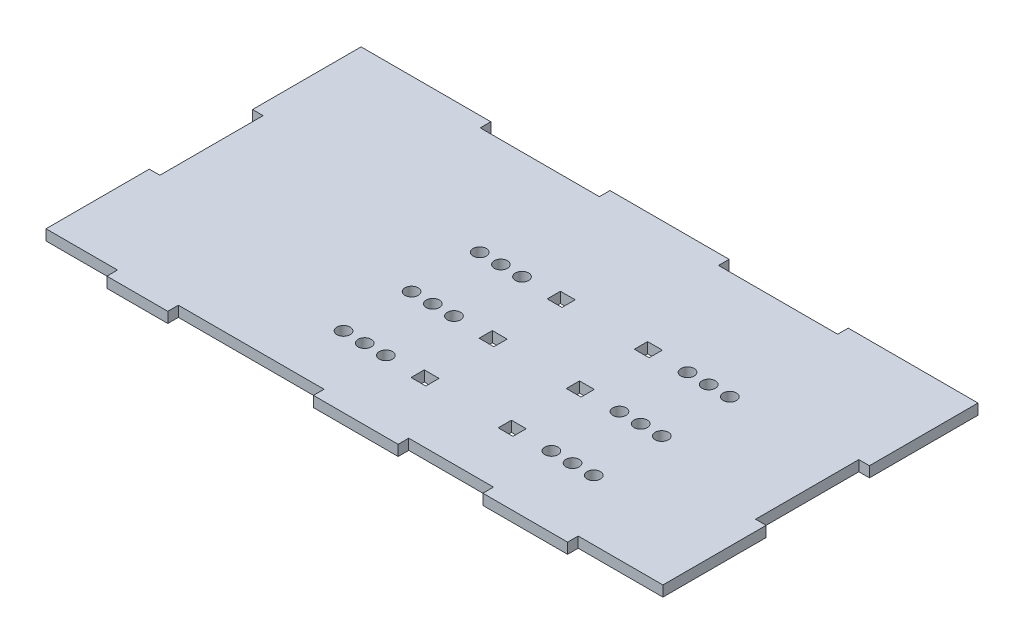
from build123d import *

# Parameters (mm, degrees)
SKETCH1_W           = 225
SKETCH1_H           = 115
BOSS_EXTRUDE1_DEPTH = 4
SKETCH3_R           = 2.5
SKETCH3_W           = 5.58
SKETCH3_H           = 5
CUT_EXTRUDE2_DEPTH  = 10
SKETCH4_W           = 4
SKETCH4_H           = 39
BOSS_EXTRUDE2_DEPTH = 4
SKETCH5_W           = 45
SKETCH5_H           = 4
BOSS_EXTRUDE3_DEPTH = 4
LPATTERN1_COUNT     = 2
LPATTERN1_PITCH     = 229
SKETCH6_W           = 23
SKETCH6_H           = 4
BOSS_EXTRUDE4_DEPTH = 4
SKETCH7_W           = 32
SKETCH7_H           = 4
BOSS_EXTRUDE5_DEPTH = 4
SKETCH8_W           = 4
SKETCH8_H           = 2
BOSS_EXTRUDE6_DEPTH = 4


with BuildPart() as part:
    # Sketch1 → Boss-Extrude1 (new body)
    with BuildSketch(Plane(origin=(0, 0, 0), x_dir=(1, 0, 0), z_dir=(0, 1, 0))):
        with Locations((112.5, 57.5)):
            Rectangle(SKETCH1_W, SKETCH1_H)
    extrude(amount=BOSS_EXTRUDE1_DEPTH)

    # Sketch3 → Cut-Extrude2 (cut)
    with BuildSketch(Plane(origin=(0, 4, 0), x_dir=(1, 0, 0), z_dir=(0, 1, 0))):
        with Locations(Location((180.08999958, 22.78, 0), (0, 0, 270))):
            Circle(SKETCH3_R)
        with Locations(Location((172.08999958, 22.78, 0), (0, 0, 270))):
            Circle(SKETCH3_R)
        with Locations(Location((164.08999958, 22.78, 0), (0, 0, 270))):
            Circle(SKETCH3_R)
        with Locations((149.29999958, 22.78)):
            Rectangle(SKETCH3_W, SKETCH3_H)
        with Locations(Location((180.08999958, 48.49, 0), (0, 0, 270))):
            Circle(SKETCH3_R)
        with Locations(Location((172.08999958, 48.49, 0), (0, 0, 270))):
            Circle(SKETCH3_R)
        with Locations(Location((164.08999958, 48.49, 0), (0, 0, 270))):
            Circle(SKETCH3_R)
        with Locations((149.29999958, 48.49)):
            Rectangle(SKETCH3_W, SKETCH3_H)
        with Locations(Location((180.08999958, 74.2, 0), (0, 0, 270))):
            Circle(SKETCH3_R)
        with Locations(Location((172.08999958, 74.2, 0), (0, 0, 270))):
            Circle(SKETCH3_R)
        with Locations(Location((164.08999958, 74.2, 0), (0, 0, 270))):
            Circle(SKETCH3_R)
        with Locations((149.29999958, 74.2)):
            Rectangle(SKETCH3_W, SKETCH3_H)
        with Locations((116.37999958, 74.2)):
            Rectangle(SKETCH3_W, SKETCH3_H)
        with Locations((116.37999958, 48.49)):
            Rectangle(SKETCH3_W, SKETCH3_H)
        with Locations((116.37999958, 22.78)):
            Rectangle(SKETCH3_W, SKETCH3_H)
        with Locations(Location((101.58999958, 22.78, 0), (0, 0, 270))):
            Circle(SKETCH3_R)
        with Locations(Location((93.58999958, 22.78, 0), (0, 0, 270))):
            Circle(SKETCH3_R)
        with Locations(Location((85.58999958, 22.78, 0), (0, 0, 270))):
            Circle(SKETCH3_R)
        with Locations(Location((85.58999958, 48.49, 0), (0, 0, 270))):
            Circle(SKETCH3_R)
        with Locations(Location((93.58999958, 48.49, 0), (0, 0, 270))):
            Circle(SKETCH3_R)
        with Locations(Location((101.58999958, 48.49, 0), (0, 0, 270))):
            Circle(SKETCH3_R)
        with Locations(Location((101.58999958, 74.2, 0), (0, 0, 270))):
            Circle(SKETCH3_R)
        with Locations(Location((93.58999958, 74.2, 0), (0, 0, 270))):
            Circle(SKETCH3_R)
        with Locations(Location((85.58999958, 74.2, 0), (0, 0, 270))):
            Circle(SKETCH3_R)
    extrude(amount=-CUT_EXTRUDE2_DEPTH, mode=Mode.SUBTRACT)

    # Sketch4 → Boss-Extrude2 (add)
    with BuildSketch(Plane(origin=(0, 4, 0), x_dir=(1, 0, 0), z_dir=(0, 1, 0))):
        with Locations((-2, 19.5)):
            Rectangle(SKETCH4_W, SKETCH4_H)
        with Locations((-2, 97.5)):
            Rectangle(SKETCH4_W, SKETCH4_H)
    boss_extrude2 = extrude(amount=-BOSS_EXTRUDE2_DEPTH)

    # Sketch5 → Boss-Extrude3 (add)
    with BuildSketch(Plane(origin=(0, 4, 0), x_dir=(1, 0, 0), z_dir=(0, 1, 0))):
        with Locations((112.5, 117)):
            Rectangle(SKETCH5_W, SKETCH5_H)
        with Locations((202.5, 117)):
            Rectangle(SKETCH5_W, SKETCH5_H)
        with Locations((22.5, 117)):
            Rectangle(SKETCH5_W, SKETCH5_H)
    extrude(amount=-BOSS_EXTRUDE3_DEPTH)

    # LPattern1: Boss-Extrude2 ×2
    with Locations(*[(i * LPATTERN1_PITCH, 0, 0) for i in range(1, LPATTERN1_COUNT)]):
        add(boss_extrude2)

    # Sketch6 → Boss-Extrude4 (add)
    with BuildSketch(Plane(origin=(0, 4, 0), x_dir=(1, 0, 0), z_dir=(0, 1, 0))):
        with Locations((34.5, -2)):
            Rectangle(SKETCH6_W, SKETCH6_H)
    extrude(amount=-BOSS_EXTRUDE4_DEPTH)

    # Sketch7 → Boss-Extrude5 (add)
    with BuildSketch(Plane(origin=(0, 4, 0), x_dir=(1, 0, 0), z_dir=(0, 1, 0))):
        with Locations((181, -2)):
            Rectangle(SKETCH7_W, SKETCH7_H)
        with Locations((117, -2)):
            Rectangle(SKETCH7_W, SKETCH7_H)
    extrude(amount=-BOSS_EXTRUDE5_DEPTH)

    # Sketch8 → Boss-Extrude6 (add)
    with BuildSketch(Plane(origin=(0, 4, 0), x_dir=(1, 0, 0), z_dir=(0, 1, 0))):
        with Locations((-2, 118)):
            Rectangle(SKETCH8_W, SKETCH8_H)
        with Locations((227, 118)):
            Rectangle(SKETCH8_W, SKETCH8_H)
    extrude(amount=-BOSS_EXTRUDE6_DEPTH)


solid = part.part
